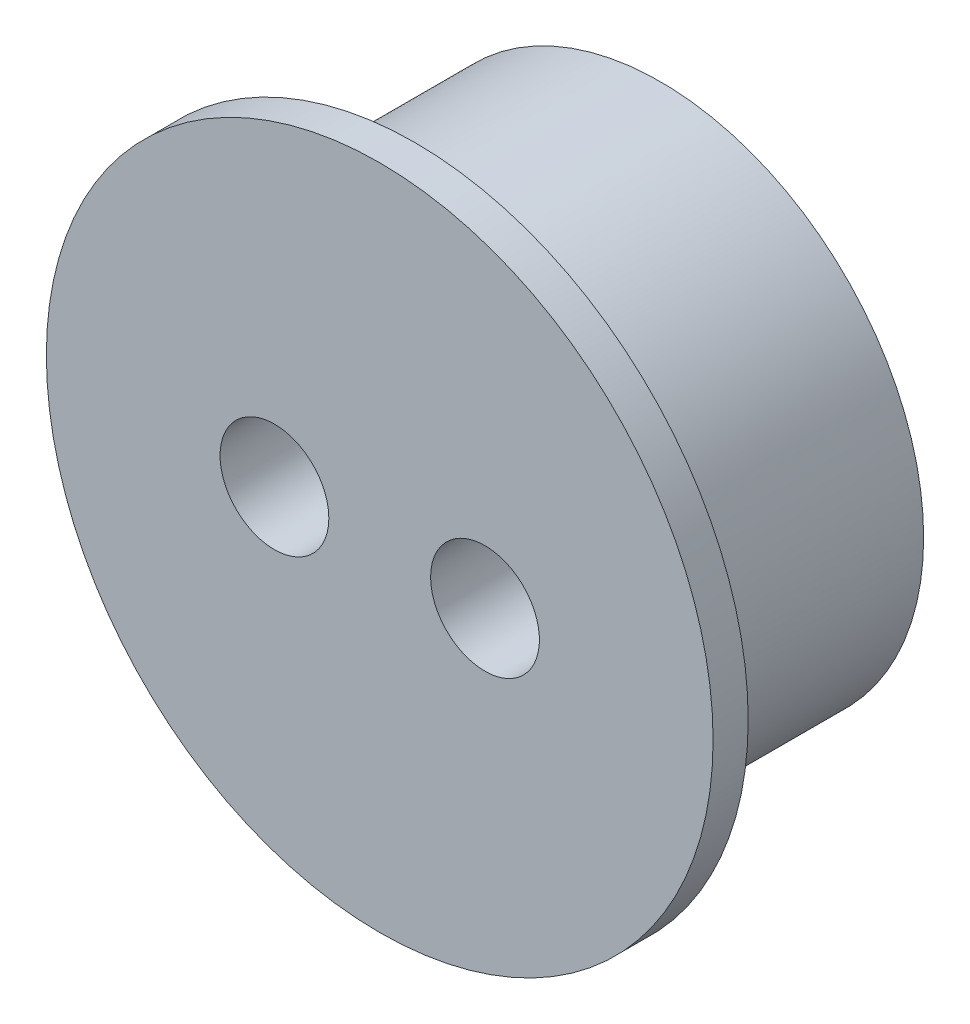
from build123d import *

# Parameters (mm, degrees)
SKETCH1_R           = 7.5
BOSS_EXTRUDE1_DEPTH = 7
SKETCH2_R           = 9.5
BOSS_EXTRUDE2_DEPTH = 1
SKETCH5_R           = 1.55
CUT_EXTRUDE2_DEPTH  = 16.636495771


with BuildPart() as part:
    # Sketch1 → Boss-Extrude1 (new body)
    with BuildSketch(Plane.XY):
        Circle(SKETCH1_R)
    extrude(amount=BOSS_EXTRUDE1_DEPTH)

    # Sketch2 → Boss-Extrude2 (add)
    with BuildSketch(Plane.XY.offset(7)):
        Circle(SKETCH2_R)
    extrude(amount=BOSS_EXTRUDE2_DEPTH)

    # Sketch5 → Cut-Extrude2 (cut, through all)
    with BuildSketch(Plane(origin=(0, 0, 0), x_dir=(-1, 0, 0), z_dir=(0, 0, -1))):
        with Locations((-3, 0)):
            Circle(SKETCH5_R)
        with Locations(Location((3, 0, 0), (0, 0, 180))):
            Circle(SKETCH5_R)
    extrude(amount=-CUT_EXTRUDE2_DEPTH, mode=Mode.SUBTRACT)


solid = part.part
